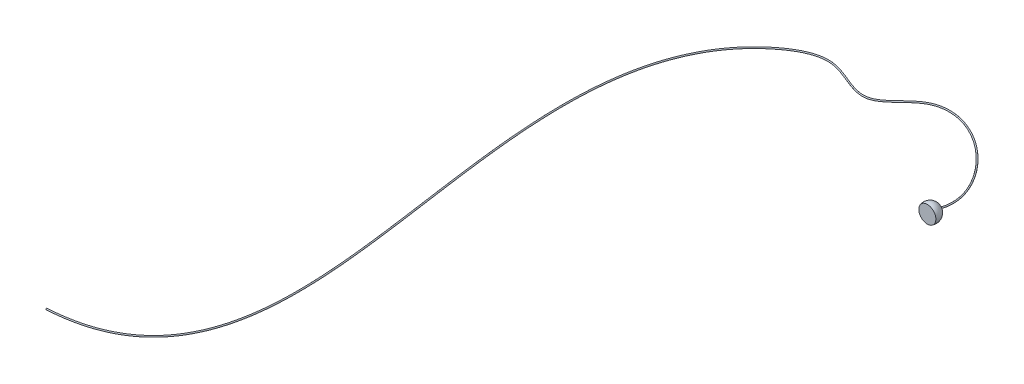
from build123d import *

# Parameters (mm, degrees)
SWEEP1_PROFILE_R = 0.035


with BuildPart() as part:
    # Sketch1 → Revolve3 (revolve)
    with BuildSketch(Plane(origin=(0, 0, 0), x_dir=(1, 0, 0), z_dir=(0, 1, 0))):
        with BuildLine():
            Line((-2.325124988, 5.080034397), (-1.848266513, 5.080034397))
            Line((-1.848266513, 5.080034397), (-1.848266513, 5.730387297))
            ThreePointArc((-1.848266513, 5.730387297), (-2.251488815, 5.526042121), (-2.325124988, 5.080034397))
        make_face()
    revolve(axis=Axis((-1.848266513, 0, -5.080034397), (0, 0, -1)))

    # Sweep1: sweep along a path in Sketch2
    with BuildLine() as sweep1_path:  # in the path sketch's own coordinates; laid on its plane below (add() does not lay a ready-made edge on the line's plane)
        add(Edge.make_bspline(
            [(-1.866828659, 5.569225919), (-0.780938989, 7.646983524), (-6.071231512, 12.922326036), (-9.081764752, 8.193910216), (-11.741085724, 10.312000481), (-24.491953187, 3.254664857), (-7.84594348, -23.20203285), (-21.827499915, -24.052259654)],
            knots=[0, 0, 0, 0, 0.162085257, 0.208443726, 0.265294078, 0.314651758, 1, 1, 1, 1], degree=3))
    # Sweep1 profile (on start of the path) → Sweep1 (sweep)
    with BuildSketch(Plane(origin=(-1.866828659, 0, -5.569225919), x_dir=(-0.8862623728587391, 0, -0.46318355589851984), z_dir=(0.46318355589851984, 0, -0.8862623728587391))):
        Circle(SWEEP1_PROFILE_R)
    sweep(path=Plane(origin=(0, 0, 0), x_dir=(1, 0, 0), z_dir=(0, 1, 0)) * sweep1_path.line)


solid = part.part
